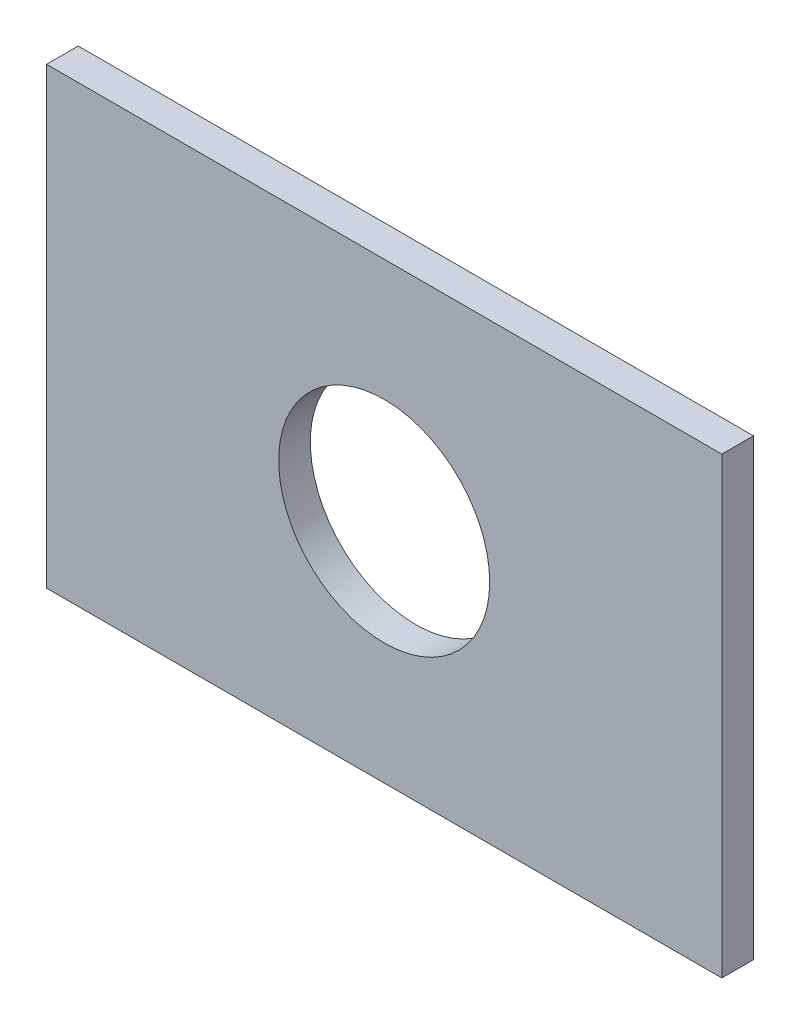
from build123d import *

# Parameters (mm, degrees)
ESQUISSE1_W      = 64
ESQUISSE1_H      = 43
ESQUISSE1_R      = 10
EXTRUSION1_DEPTH = 3


with BuildPart() as part:
    # Esquisse1 → Extrusion1 (new body)
    with BuildSketch(Plane.XY):
        Rectangle(ESQUISSE1_W, ESQUISSE1_H)
        Circle(ESQUISSE1_R, mode=Mode.SUBTRACT)
    extrude(amount=EXTRUSION1_DEPTH)


solid = part.part
